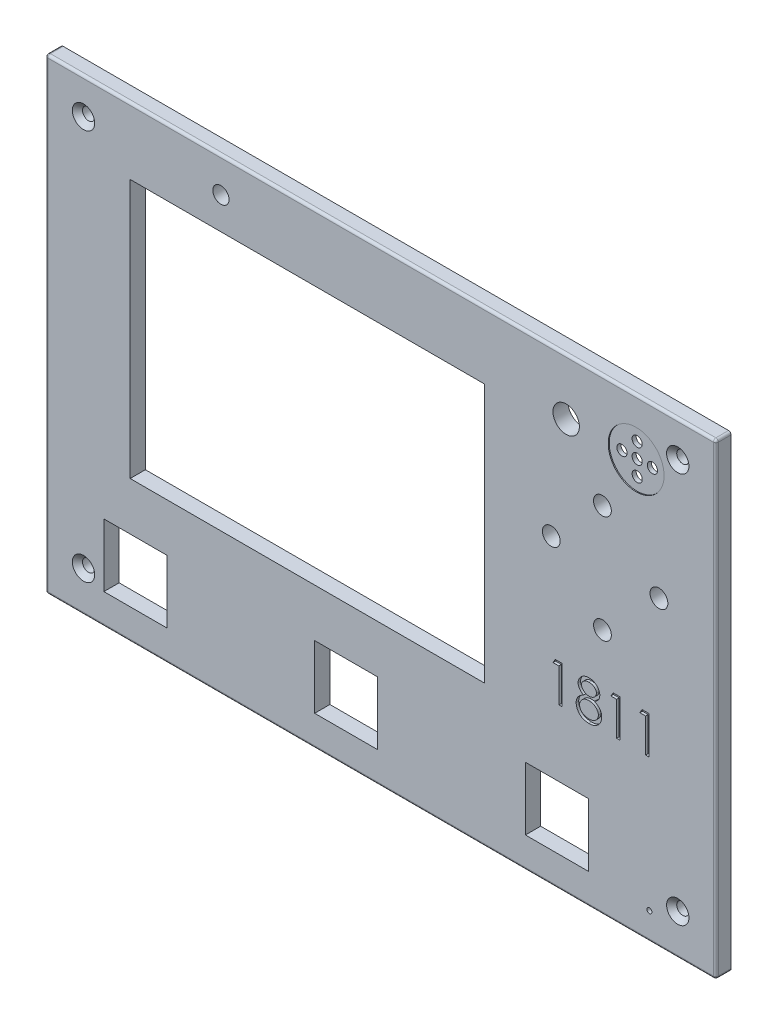
from build123d import *

# Parameters (mm, degrees)
ESQUISSE1_W                                    = 132
ESQUISSE1_H                                    = 92
BOSS_EXTRU_1_DEPTH                             = 3
ESQUISSE2_W                                    = 69.8
ESQUISSE2_H                                    = 51
ENL_V_MAT_EXTRU_1_DEPTH                        = 3
ESQUISSE3_W                                    = 12.4
ESQUISSE3_H                                    = 12.4
ENL_V_MAT_EXTRU_2_DEPTH                        = 3
ESQUISSE5_W                                    = 12.4
ESQUISSE5_H                                    = 12.4
ENL_V_MAT_EXTRU_3_DEPTH                        = 3
ESQUISSE7_R                                    = 1.75
ENL_V_MAT_EXTRU_5_DEPTH                        = 3
ESQUISSE6_W                                    = 12.4
ESQUISSE6_H                                    = 12.4
ENL_V_MAT_EXTRU_6_DEPTH                        = 3
ESQUISSE8_R                                    = 1.6
ENL_V_MAT_EXTRU_7_DEPTH                        = 3
ESQUISSE9_R                                    = 2.6
ENL_V_MAT_EXTRU_8_DEPTH                        = 3
ENL_V_MAT_EXTRU_9_DEPTH                        = 98.437468046
ENL_V_MAT_EXTRU_9_DEPTH_BACK                   = 3
ESQUISSE10_R                                   = 1
ESQUISSE12_R                                   = 5.5
ENL_V_MAT_EXTRU_10_DEPTH                       = 0.2
CONG_1_R                                       = 0.5
CONG_2_R                                       = 0.5
CONG_3_R                                       = 0.5
CONG_4_R                                       = 0.5
ESQUISSE15_R                                   = 1.15
ENL_V_MAT_EXTRU_11_DEPTH                       = 3
ESQUISSE20_R                                   = 0.5
ENL_V_MAT_EXTRU_12_DEPTH                       = 3
FRAISAGE_POUR_VIS_T_TE_FRAIS_E_M23_D           = 2.4
FRAISAGE_POUR_VIS_T_TE_FRAIS_E_M23_CSINK_D     = 4.4
FRAISAGE_POUR_VIS_T_TE_FRAIS_E_M23_CSINK_ANGLE = 90
ESQUISSE23_R                                   = 6.5
ENL_V_MAT_EXTRU_13_DEPTH                       = 2
ENL_V_MAT_EXTRU_17_DEPTH                       = 0.5


with BuildPart() as part:
    # Esquisse1 → Boss.-Extru.1 (new body)
    with BuildSketch(Plane.XY):
        with Locations((13.801143929, 9.828645038)):
            Rectangle(ESQUISSE1_W, ESQUISSE1_H)
    extrude(amount=BOSS_EXTRU_1_DEPTH)

    # Esquisse2 → Enlèv. mat.-Extru.1 (cut)
    with BuildSketch(Plane.XY.offset(3)):
        with Locations((-0.618856071, 17.228645038)):
            Rectangle(ESQUISSE2_W, ESQUISSE2_H)
    extrude(amount=-ENL_V_MAT_EXTRU_1_DEPTH, mode=Mode.SUBTRACT)

    # Esquisse3 → Enlèv. mat.-Extru.2 (cut)
    with BuildSketch(Plane.XY.offset(3)):
        with Locations((-34.488856071, -23.941354962)):
            Rectangle(ESQUISSE3_W, ESQUISSE3_H)
    extrude(amount=-ENL_V_MAT_EXTRU_2_DEPTH, mode=Mode.SUBTRACT)

    # Esquisse5 → Enlèv. mat.-Extru.3 (cut)
    with BuildSketch(Plane.XY.offset(3)):
        with Locations((7.011143929, -23.941354962)):
            Rectangle(ESQUISSE5_W, ESQUISSE5_H)
    extrude(amount=-ENL_V_MAT_EXTRU_3_DEPTH, mode=Mode.SUBTRACT)

    # Esquisse7 → Enlèv. mat.-Extru.5 (cut)
    with BuildSketch(Plane.XY.offset(3)):
        with Locations((57.471143929, 12.398645038)):
            Circle(ESQUISSE7_R)
        with Locations((68.601143929, 23.368645038)):
            Circle(ESQUISSE7_R)
        with Locations((57.471143929, 33.598645038)):
            Circle(ESQUISSE7_R)
        with Locations((47.401143929, 23.368645038)):
            Circle(ESQUISSE7_R)
    extrude(amount=-ENL_V_MAT_EXTRU_5_DEPTH, mode=Mode.SUBTRACT)

    # Esquisse6 → Enlèv. mat.-Extru.6 (cut)
    with BuildSketch(Plane.XY.offset(3)):
        with Locations((48.511143929, -23.941354962)):
            Rectangle(ESQUISSE6_W, ESQUISSE6_H)
    extrude(amount=-ENL_V_MAT_EXTRU_6_DEPTH, mode=Mode.SUBTRACT)

    # Esquisse8 → Enlèv. mat.-Extru.7 (cut)
    with BuildSketch(Plane.XY.offset(3)):
        with Locations((-17.648856071, 49.018645038)):
            Circle(ESQUISSE8_R)
    extrude(amount=-ENL_V_MAT_EXTRU_7_DEPTH, mode=Mode.SUBTRACT)

    # Esquisse9 → Enlèv. mat.-Extru.8 (cut)
    with BuildSketch(Plane.XY.offset(3)):
        with Locations((50.331143929, 44.768645038)):
            Circle(ESQUISSE9_R)
    extrude(amount=-ENL_V_MAT_EXTRU_8_DEPTH, mode=Mode.SUBTRACT)

    # Esquisse10 → Enlèv. mat.-Extru.9 (cut, two sides: drawn at the far end of the back side and taken through both)
    with BuildSketch(Plane.XY.offset(3).offset(-ENL_V_MAT_EXTRU_9_DEPTH_BACK)):
        with Locations(Location((64.111143929, 44.768645038, 0), (0, 0, 180))):
            Circle(ESQUISSE10_R)
        with Locations(Location((64.111143929, 47.768645038, 0), (0, 0, 180))):
            Circle(ESQUISSE10_R)
        with Locations(Location((64.111143929, 41.768645038, 0), (0, 0, 180))):
            Circle(ESQUISSE10_R)
        with Locations(Location((61.111143929, 44.768645038, 0), (0, 0, 180))):
            Circle(ESQUISSE10_R)
        with Locations(Location((67.111143929, 44.768645038, 0), (0, 0, 180))):
            Circle(ESQUISSE10_R)
    extrude(amount=ENL_V_MAT_EXTRU_9_DEPTH + ENL_V_MAT_EXTRU_9_DEPTH_BACK, mode=Mode.SUBTRACT)

    # Esquisse12 → Enlèv. mat.-Extru.10 (cut)
    with BuildSketch(Plane.XY.offset(3)):
        with Locations((64.111143929, 44.768645038)):
            Circle(ESQUISSE12_R)
    extrude(amount=-ENL_V_MAT_EXTRU_10_DEPTH, mode=Mode.SUBTRACT)

    # Congé1
    cong_1_edges = [part.edges().sort_by_distance(p)[0] for p in [
        (-52.198856071, 9.828645038, 3),
    ]]
    fillet(cong_1_edges, radius=CONG_1_R)

    # Congé2
    cong_2_edges = [part.edges().sort_by_distance(p)[0] for p in [
        (14.051143929, -36.171354962, 3),
        (-52.198856071, -36.171354962, 1.25),
        (-52.052409461, -36.171354962, 2.853553391),
    ]]
    fillet(cong_2_edges, radius=CONG_2_R)

    # Congé3
    cong_3_edges = [part.edges().sort_by_distance(p)[0] for p in [
        (79.801143929, -36.171354962, 1.25),
        (79.801143929, 10.078645038, 3),
        (79.801143929, -36.024908352, 2.853553391),
    ]]
    fillet(cong_3_edges, radius=CONG_3_R)

    # Congé4
    cong_4_edges = [part.edges().sort_by_distance(p)[0] for p in [
        (-52.198856071, 55.828645038, 1.25),
        (-52.052409461, 55.828645038, 2.853553391),
        (79.801143929, 55.828645038, 1.25),
        (13.801143929, 55.828645038, 3),
        (79.65469732, 55.828645038, 2.853553391),
    ]]
    fillet(cong_4_edges, radius=CONG_4_R)

    # Esquisse15 → Enlèv. mat.-Extru.11 (cut)
    with BuildSketch(Plane.XY.offset(3)):
        with Locations((-44.698856071, 48.828645038)):
            Circle(ESQUISSE15_R)
        with Locations((72.301143929, 48.828645038)):
            Circle(ESQUISSE15_R)
        with Locations((-44.698856071, -28.171354962)):
            Circle(ESQUISSE15_R)
        with Locations((72.301143929, -28.171354962)):
            Circle(ESQUISSE15_R)
    extrude(amount=-ENL_V_MAT_EXTRU_11_DEPTH, mode=Mode.SUBTRACT)

    # Esquisse20 → Enlèv. mat.-Extru.12 (cut)
    with BuildSketch(Plane.XY.offset(3)):
        with Locations((66.711143929, -30.841354962)):
            Circle(ESQUISSE20_R)
    extrude(amount=-ENL_V_MAT_EXTRU_12_DEPTH, mode=Mode.SUBTRACT)

    # Fraisage pour vis à tête fraisée M23 (through all)
    with Locations(Plane.XY.offset(3)):
        with Locations((72.301143929, 48.828645038), (-44.698856071, 48.828645038), (-44.698856071, -28.171354962), (72.301143929, -28.171354962)):
            CounterSinkHole(FRAISAGE_POUR_VIS_T_TE_FRAIS_E_M23_D / 2, FRAISAGE_POUR_VIS_T_TE_FRAIS_E_M23_CSINK_D / 2, counter_sink_angle=FRAISAGE_POUR_VIS_T_TE_FRAIS_E_M23_CSINK_ANGLE)

    # Esquisse23 → Enlèv. mat.-Extru.13 (cut)
    with BuildSketch(Plane(origin=(0, 0, 0), x_dir=(-1, 0, 0), z_dir=(0, 0, -1))):
        with Locations((-64.111143929, 44.768645038)):
            Circle(ESQUISSE23_R)
    extrude(amount=-ENL_V_MAT_EXTRU_13_DEPTH, mode=Mode.SUBTRACT)

    # Esquisse24 → Enlèv. mat.-Extru.17 (cut)
    # profile 1 of 4: a face of its own
    with BuildSketch(Plane.XY.offset(3)):
        Polygon((48.176182968, 2.733677062), (49.545952933, 2.733677062), (49.545952933, -4.674656271), (48.881102506, -4.674656271), (48.881102506, 1.973848002), (47.741358916, 1.973848002), align=None)
    # profile 2 of 4: a face of its own
    with BuildSketch(Plane.XY.offset(3)):
        with BuildLine():
            add(Edge.make_bspline(
                [(55.902101104, -0.547537882), (55.962740529, -0.579156555), (56.081007658, -0.640823528), (56.249446082, -0.740118113), (56.403380668, -0.844768156), (56.547082358, -0.949830725), (56.67802645, -1.059329387), (56.794748791, -1.173699568), (56.900132586, -1.290086485), (56.992052612, -1.41046098), (57.072902583, -1.534503254), (57.14277827, -1.662538882), (57.202504682, -1.794287272), (57.249839569, -1.931186562), (57.288832362, -2.071225782), (57.315662392, -2.216213177), (57.330091535, -2.365193366), (57.332819523, -2.465879604), (57.334200797, -2.516860465)],
                knots=[0, 0, 0, 0, 1.272397273, 2.481599622, 3.635517121, 4.734568067, 5.792894095, 6.808321871, 7.773003508, 8.711915296, 9.623354172, 10.525449501, 11.423591555, 12.311487226, 13.218079475, 14.126165749, 15.051214107, 16, 16, 16, 16], degree=3))
            add(Edge.make_bspline(
                [(57.334200797, -2.516860465), (57.332567956, -2.588187332), (57.329335953, -2.729369966), (57.30118432, -2.937747568), (57.259035182, -3.14012584), (57.197483548, -3.336460412), (57.117656871, -3.525667919), (57.019280901, -3.707910323), (56.907920517, -3.886174527), (56.818486611, -3.995858928), (56.773233248, -4.051358996)],
                knots=[0, 0, 0, 0, 1.025265484, 2.029385089, 3.018602448, 3.995076438, 4.983346944, 5.966715145, 6.97116228, 8, 8, 8, 8], degree=3))
            add(Edge.make_bspline(
                [(56.773233248, -4.051358996), (56.714312711, -4.116115818), (56.597199734, -4.244829244), (56.396575871, -4.411941792), (56.176396217, -4.552381342), (55.937512746, -4.666833519), (55.680564014, -4.755915254), (55.405604771, -4.819928584), (55.112098981, -4.856594392), (54.910369067, -4.861894504), (54.806878748, -4.864613536)],
                knots=[0, 0, 0, 0, 0.954267603, 1.896743057, 2.838368354, 3.796610408, 4.779680527, 5.799409237, 6.871065594, 8, 8, 8, 8], degree=3))
            add(Edge.make_bspline(
                [(54.806878748, -4.864613536), (54.707367075, -4.862174125), (54.513727468, -4.857427277), (54.231876627, -4.82526573), (53.969149463, -4.768903413), (53.724018363, -4.691762323), (53.497961129, -4.591410673), (53.291621898, -4.466509541), (53.102023657, -4.322086322), (52.934920288, -4.15399319), (52.786566415, -3.973954027), (52.656247369, -3.788213119), (52.547928903, -3.596753512), (52.456219885, -3.402430035), (52.386014237, -3.202519009), (52.337389725, -2.998048981), (52.30650901, -2.789377096), (52.302400275, -2.648551763), (52.300333275, -2.577706151)],
                knots=[0, 0, 0, 0, 1.256902934, 2.445805442, 3.576955095, 4.645999104, 5.686449165, 6.692658513, 7.68621702, 8.689161843, 9.678783111, 10.630372946, 11.551080876, 12.453998257, 13.34127905, 14.221779781, 15.105423033, 16, 16, 16, 16], degree=3))
            add(Edge.make_bspline(
                [(52.300333275, -2.577706151), (52.301556457, -2.525722528), (52.303973895, -2.422984541), (52.320705824, -2.271199796), (52.3476054, -2.123464644), (52.384137917, -1.979233403), (52.433648923, -1.839556109), (52.493428105, -1.70377094), (52.563134071, -1.571724597), (52.643739204, -1.442694966), (52.737511821, -1.318489998), (52.843691547, -1.19700181), (52.964400535, -1.080115524), (53.098295913, -0.966403058), (53.243847522, -0.853847247), (53.404835961, -0.748530955), (53.576993495, -0.642998263), (53.69934827, -0.579903974), (53.762113791, -0.547537882)],
                knots=[0, 0, 0, 0, 0.941657376, 1.861047343, 2.762797495, 3.66048619, 4.553285746, 5.444104102, 6.34607688, 7.256116206, 8.197091036, 9.162375105, 10.176350973, 11.237807142, 12.343728897, 13.50695164, 14.721116704, 16, 16, 16, 16], degree=3))
            add(Edge.make_bspline(
                [(53.762113791, -0.547537882), (53.676195381, -0.500685955), (53.509833291, -0.409967511), (53.289552974, -0.243286771), (53.100342821, -0.062760896), (52.947403669, 0.135422169), (52.827024119, 0.345071387), (52.74443474, 0.564875054), (52.688562182, 0.790757494), (52.683027465, 0.94507561), (52.680247805, 1.022577636)],
                knots=[0, 0, 0, 0, 1.166880483, 2.259407225, 3.286803203, 4.280235371, 5.237608625, 6.161067461, 7.076446754, 8, 8, 8, 8], degree=3))
            add(Edge.make_bspline(
                [(52.680247805, 1.022577636), (52.683709453, 1.101524135), (52.690667968, 1.260220365), (52.746935997, 1.496453326), (52.838630138, 1.728475055), (52.963346248, 1.955160981), (53.118682522, 2.168838935), (53.305047711, 2.360483938), (53.517991356, 2.528359909), (53.756450508, 2.669279475), (54.013067207, 2.783968219), (54.283822155, 2.863085881), (54.563997899, 2.914808995), (54.754704739, 2.92066508), (54.851399982, 2.923634327)],
                knots=[0, 0, 0, 0, 0.888701115, 1.786444228, 2.72001202, 3.692817113, 4.693886446, 5.687152267, 6.695133018, 7.739871481, 8.800368666, 9.853104506, 10.91144658, 12, 12, 12, 12], degree=3))
            add(Edge.make_bspline(
                [(54.851399982, 2.923634327), (54.945599724, 2.920572901), (55.131350883, 2.914536117), (55.404389511, 2.864187225), (55.665638835, 2.780093075), (55.914197941, 2.666010619), (56.145617061, 2.525491594), (56.350091949, 2.355309744), (56.53071258, 2.164510128), (56.680116215, 1.950896968), (56.803227664, 1.725082091), (56.888954572, 1.488814422), (56.94388625, 1.247198914), (56.950814871, 1.083711806), (56.954286267, 1.00180106)],
                knots=[0, 0, 0, 0, 1.072916533, 2.115669174, 3.151510826, 4.193348718, 5.225979165, 6.227137561, 7.216255879, 8.211077061, 9.189680878, 10.138522389, 11.067357538, 12, 12, 12, 12], degree=3))
            add(Edge.make_bspline(
                [(56.954286267, 1.00180106), (56.95124978, 0.921417122), (56.945286293, 0.763547635), (56.895121421, 0.533409834), (56.81063824, 0.317886518), (56.695292262, 0.114532103), (56.54495498, -0.072965401), (56.361633162, -0.246990262), (56.146788366, -0.408972049), (55.98536949, -0.500383186), (55.902101104, -0.547537882)],
                knots=[0, 0, 0, 0, 0.975232327, 1.915300861, 2.843280834, 3.77672583, 4.742871857, 5.749627742, 6.839139064, 8, 8, 8, 8], degree=3))
        make_face()
        with BuildLine():
            add(Edge.make_bspline(
                [(54.814298954, 2.163805267), (54.762333081, 2.162426385), (54.660665113, 2.159728688), (54.511591092, 2.145634573), (54.369832915, 2.11821693), (54.23390947, 2.081728324), (54.105684317, 2.032435416), (53.98341601, 1.974449313), (53.869185458, 1.903951474), (53.7616137, 1.824870272), (53.664774561, 1.737890288), (53.57882826, 1.647267916), (53.507437085, 1.551223336), (53.446813403, 1.452145642), (53.402825858, 1.347094255), (53.369881415, 1.239289932), (53.347611136, 1.127370369), (53.345942377, 1.050881422), (53.345098232, 1.012189348)],
                knots=[0, 0, 0, 0, 1.203892937, 2.355340988, 3.463153438, 4.544400666, 5.610487187, 6.640501085, 7.674077295, 8.714426146, 9.728707835, 10.68524104, 11.601827946, 12.495867327, 13.368432065, 14.231010473, 15.105153427, 16, 16, 16, 16], degree=3))
            add(Edge.make_bspline(
                [(53.345098232, 1.012189348), (53.346553159, 0.973495603), (53.349428303, 0.897031204), (53.371664157, 0.784115788), (53.4048045, 0.673156657), (53.456981733, 0.566792228), (53.519563859, 0.461332785), (53.59680415, 0.359414044), (53.688855925, 0.260681313), (53.792630674, 0.165974362), (53.905685096, 0.077288647), (54.025454654, 0.000298746), (54.150436182, -0.064120121), (54.279345562, -0.117734028), (54.413496609, -0.159411062), (54.552067311, -0.18897803), (54.695080958, -0.207354923), (54.791983187, -0.209549952), (54.841011694, -0.210660545)],
                knots=[0, 0, 0, 0, 0.873023192, 1.725219244, 2.590779336, 3.480155217, 4.391973325, 5.357036234, 6.360879153, 7.436073238, 8.526419356, 9.601555421, 10.645666583, 11.697338044, 12.750135903, 13.812665442, 14.89329948, 16, 16, 16, 16], degree=3))
            add(Edge.make_bspline(
                [(54.841011694, -0.210660545), (54.903982747, -0.208812976), (55.029302892, -0.205136087), (55.214044144, -0.170949436), (55.393670074, -0.117173577), (55.566260755, -0.043598315), (55.727348794, 0.048747322), (55.870943605, 0.15930721), (55.995820362, 0.285528483), (56.10068132, 0.425446152), (56.181982162, 0.574357014), (56.245274322, 0.7237943), (56.282233894, 0.875352356), (56.287054744, 0.976882429), (56.289435839, 1.02702976)],
                knots=[0, 0, 0, 0, 1.076279235, 2.141928126, 3.20205304, 4.278698113, 5.344010996, 6.36967002, 7.368914609, 8.37248503, 9.349703398, 10.264243087, 11.142681841, 12, 12, 12, 12], degree=3))
            add(Edge.make_bspline(
                [(56.289435839, 1.02702976), (56.288309989, 1.062225769), (56.286075339, 1.132084803), (56.26766022, 1.235247676), (56.237231374, 1.336063628), (56.196034521, 1.435365501), (56.141827122, 1.53176005), (56.077556259, 1.626762587), (55.999484064, 1.718235953), (55.911861613, 1.808311865), (55.812493832, 1.891674715), (55.701572217, 1.964984851), (55.579665446, 2.027241006), (55.446770635, 2.077805537), (55.303377212, 2.11578351), (55.150145628, 2.14422378), (54.985798215, 2.160253532), (54.872705242, 2.162595678), (54.814298954, 2.163805267)],
                knots=[0, 0, 0, 0, 0.814439003, 1.616544685, 2.417341072, 3.248991801, 4.09997495, 4.973547432, 5.9003056, 6.880240646, 7.880314356, 8.896779544, 9.951930927, 11.043077905, 12.18215768, 13.381699519, 14.647792085, 16, 16, 16, 16], degree=3))
        make_face(mode=Mode.SUBTRACT)
        with BuildLine():
            add(Edge.make_bspline(
                [(54.857336146, -0.970489605), (54.791453234, -0.971661479), (54.662207035, -0.97396041), (54.472856537, -0.999549853), (54.291134003, -1.035172068), (54.117652137, -1.089212343), (53.952484199, -1.159478247), (53.794736054, -1.244006357), (53.645614497, -1.343924545), (53.507178726, -1.457963381), (53.380764345, -1.580855892), (53.26985461, -1.710950745), (53.175668192, -1.845830106), (53.099821144, -1.987206991), (53.037566312, -2.132087767), (52.996685271, -2.284080511), (52.970477315, -2.440263234), (52.966958078, -2.546435442), (52.965183703, -2.599966768)],
                knots=[0, 0, 0, 0, 1.140299081, 2.23698856, 3.303958914, 4.344563908, 5.37730929, 6.408454204, 7.439741482, 8.480804886, 9.510774543, 10.48932336, 11.43758569, 12.353841022, 13.263987381, 14.161954604, 15.073269652, 16, 16, 16, 16], degree=3))
            add(Edge.make_bspline(
                [(52.965183703, -2.599966768), (52.968069267, -2.666495519), (52.973794159, -2.798487008), (53.019210711, -2.993565508), (53.092099262, -3.182416741), (53.193752635, -3.363501708), (53.319625664, -3.532729433), (53.474410021, -3.680237341), (53.648486461, -3.811304471), (53.847744919, -3.917308267), (54.065398505, -4.001964043), (54.301389331, -4.060290831), (54.552330576, -4.0989019), (54.725600046, -4.102792716), (54.814298954, -4.104784476)],
                knots=[0, 0, 0, 0, 0.898778495, 1.783155532, 2.693654817, 3.627872908, 4.583023416, 5.533784346, 6.509005473, 7.520592997, 8.575161974, 9.658835044, 10.801527049, 12, 12, 12, 12], degree=3))
            add(Edge.make_bspline(
                [(54.814298954, -4.104784476), (54.883620566, -4.103453499), (55.018681296, -4.100860327), (55.215713221, -4.077970071), (55.401650849, -4.041670032), (55.576133606, -3.98887286), (55.741114733, -3.924420409), (55.893796999, -3.84150617), (56.038108215, -3.747203753), (56.166937275, -3.635320655), (56.2842709, -3.515772391), (56.386576369, -3.3892168), (56.475386519, -3.259093378), (56.545090375, -3.122461519), (56.600814279, -2.98194255), (56.640869137, -2.836240718), (56.665583792, -2.684909141), (56.668083355, -2.582252774), (56.669350369, -2.530216835)],
                knots=[0, 0, 0, 0, 1.224942928, 2.386581632, 3.501229538, 4.569074225, 5.605009692, 6.626002462, 7.634866581, 8.645888296, 9.63523824, 10.59253846, 11.518950513, 12.414518923, 13.29783783, 14.186679152, 15.080837789, 16, 16, 16, 16], degree=3))
            add(Edge.make_bspline(
                [(56.669350369, -2.530216835), (56.66743299, -2.479676464), (56.663652253, -2.380019681), (56.639656256, -2.2323472), (56.597500983, -2.08967791), (56.539657993, -1.950295397), (56.462651622, -1.817023818), (56.371963313, -1.686391255), (56.262544096, -1.562023448), (56.1389041, -1.442954394), (56.0041593, -1.332854418), (55.86093051, -1.23545719), (55.710320232, -1.153431877), (55.552647169, -1.086721962), (55.388261426, -1.034255151), (55.217283911, -0.997602961), (55.039514445, -0.974532135), (54.918748301, -0.971852338), (54.857336146, -0.970489605)],
                knots=[0, 0, 0, 0, 0.917430815, 1.809013306, 2.70690318, 3.612392954, 4.541220862, 5.495268465, 6.494511384, 7.542276156, 8.608045339, 9.649016899, 10.681629292, 11.715607085, 12.752076957, 13.808767841, 14.885711793, 16, 16, 16, 16], degree=3))
        make_face(mode=Mode.SUBTRACT)
    # profile 3 of 4: a face of its own
    with BuildSketch(Plane.XY.offset(3)):
        Polygon((59.573618865, 2.733677062), (60.943388831, 2.733677062), (60.943388831, -4.674656271), (60.278538403, -4.674656271), (60.278538403, 1.973848002), (59.138794814, 1.973848002), align=None)
    # profile 4 of 4: a face of its own
    with BuildSketch(Plane.XY.offset(3)):
        Polygon((65.272336814, 2.733677062), (66.642106779, 2.733677062), (66.642106779, -4.674656271), (65.977256352, -4.674656271), (65.977256352, 1.973848002), (64.837512762, 1.973848002), align=None)
    extrude(amount=-ENL_V_MAT_EXTRU_17_DEPTH, mode=Mode.SUBTRACT)


solid = part.part
